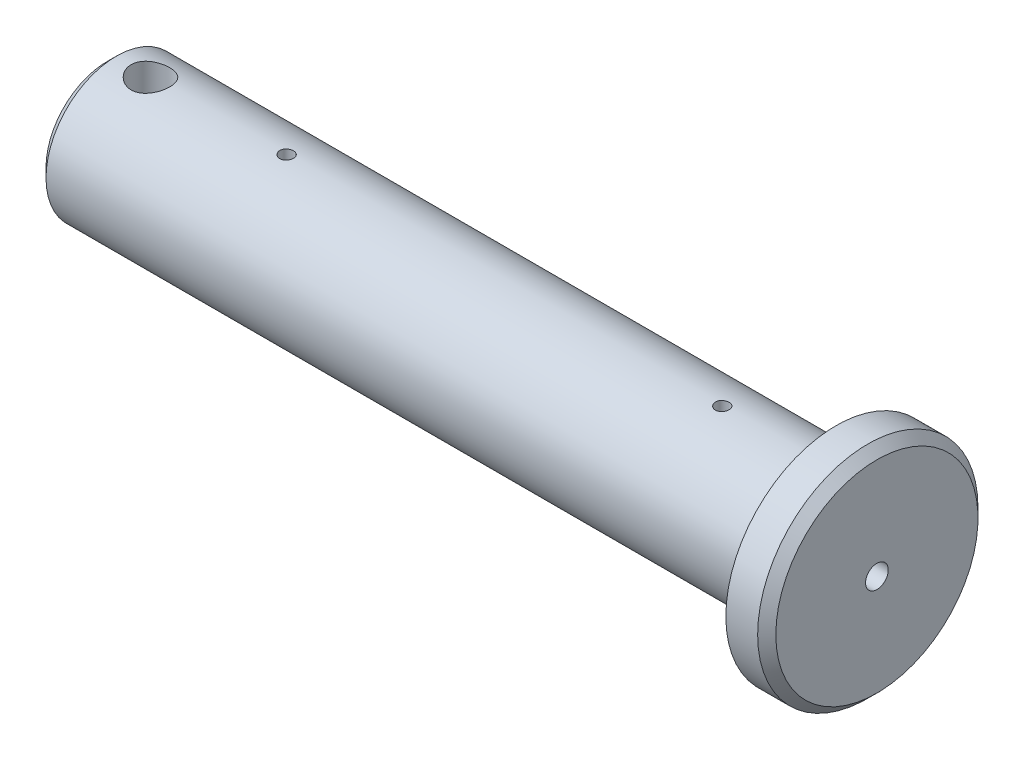
from build123d import *

# Parameters (mm, degrees)
ESBO_O2_R                  = 1.5
CORTE_EXTRUS_O1_DEPTH      = 92.370241873
CORTE_EXTRUS_O2_DEPTH      = 92.370241873
CORTE_EXTRUS_O2_DEPTH_BACK = 92.370241873
ESBO_O3_R                  = 4.25


with BuildPart() as part:
    # Esboço1 → Revolução1 (revolve)
    with BuildSketch(Plane.XY, mode=Mode.PRIVATE) as revolu_o1_sk:
        Polygon((84.69, 2.5), (84.69, 22.25), (82.69, 24.25), (75.69, 24.25), (75.69, 15.5), (-82.69, 15.5), (-84.69, 13.5), (-84.69, 0), (-51.69, 0), (-50.788709071, 1.5), (74.089139381, 1.5), (74.69, 2.5), align=None)
    revolve(revolu_o1_sk.sketch.rotate(Axis((-84.69, 0, 0), (1, 0, 0)), 90), axis=Axis((-84.69, 0, 0), (1, 0, 0)))

    # Esboço2 → Corte-extrusão1 (cut, through all)
    with BuildSketch(Plane(origin=(0, 0, 0), x_dir=(1, 0, 0), z_dir=(0, 1, 0))):
        with Locations(Location((50.66, 0, 0), (0, 0, 90))):
            Circle(ESBO_O2_R)
        with Locations(Location((-45.22, 0, 0), (0, 0, 90))):
            Circle(ESBO_O2_R)
    extrude(amount=CORTE_EXTRUS_O1_DEPTH, mode=Mode.SUBTRACT)

    # Esboço3 → Corte-extrusão2 (cut, two sides: drawn at the far end of the back side and taken through both)
    with BuildSketch(Plane(origin=(0, 0, 0), x_dir=(1, 0, 0), z_dir=(0, 1, 0)).offset(-CORTE_EXTRUS_O2_DEPTH_BACK)):
        with Locations(Location((-75.19, 0, 0), (0, 0, 270))):
            Circle(ESBO_O3_R)
    extrude(amount=CORTE_EXTRUS_O2_DEPTH + CORTE_EXTRUS_O2_DEPTH_BACK, mode=Mode.SUBTRACT)


solid = part.part
